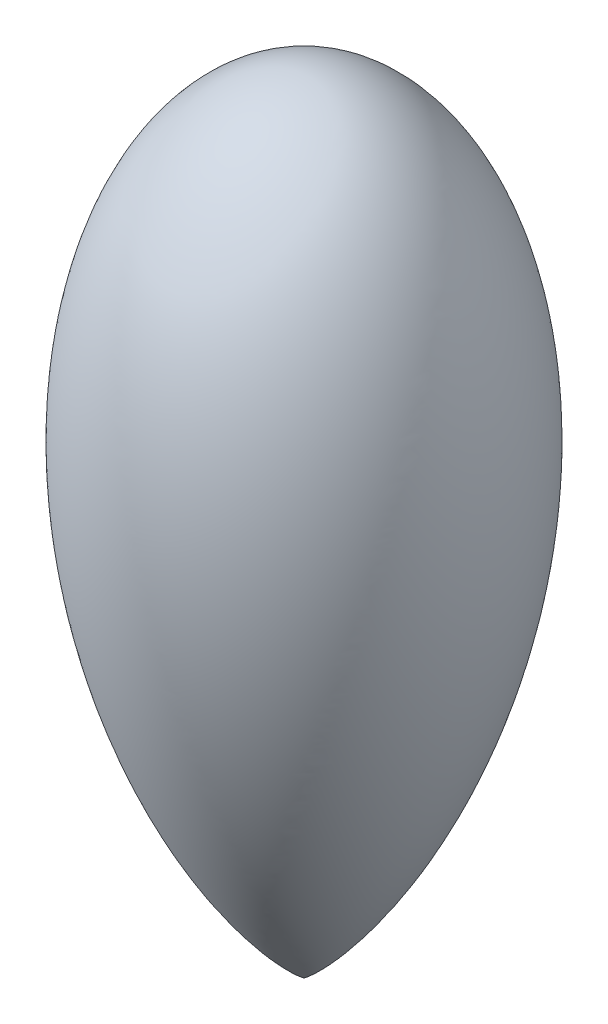
from build123d import *


with BuildPart() as part:
    # Sketch → Revolve 2 (revolve)
    with BuildSketch(Plane.XY):
        with BuildLine():
            Line((0, 397.88735773), (0, 0))
            add(Edge.make_bspline(
                [(0, 397.88735773), (0.142763625, 397.88735773), (0.428381043, 397.886231566), (0.960353225, 397.88116383), (1.535148694, 397.867652102), (2.331730097, 397.842324597), (3.246803667, 397.798444417), (4.337620845, 397.727621056), (5.567439546, 397.619865455), (6.802590902, 397.485435789), (8.029973634, 397.324505894), (9.256300325, 397.137281541), (10.47686203, 396.923999318), (11.997505999, 396.625156484), (13.811199953, 396.215547728), (15.909917497, 395.664697671), (18.280610107, 394.937999999), (20.620516548, 394.117367993), (22.926610288, 393.206259601), (25.196467356, 392.208298174), (27.985731378, 390.856962272), (31.252374207, 389.076715527), (34.655769288, 386.961468043), (38.162597245, 384.486727713), (41.278533823, 382.047149864), (44.03478943, 379.695399266), (46.712228243, 377.218856876), (49.309459025, 374.624260197), (52.458710603, 371.237111046), (56.061477594, 366.975711237), (59.987235037, 361.780670335), (64.301086928, 355.301256015), (68.405595265, 348.286566977), (72.111592664, 341.053624009), (75.443792469, 333.642399047), (78.315865157, 326.409780552), (80.788090559, 319.393915412), (83.000297793, 312.291991965), (84.964565187, 305.117720973), (87.123734603, 296.074187207), (89.260936231, 285.121341877), (91.13244365, 272.235269984), (92.478845353, 257.415887104), (93.083176306, 242.548610516), (92.963317475, 223.950196777), (91.489318872, 201.671593696), (87.95656127, 175.854453078), (82.385132936, 150.401479659), (76.213823763, 128.947781242), (70.153306593, 111.365996188), (64.755636395, 97.501990199), (58.806049893, 83.865481679), (52.29703594, 70.486657309), (46.100190521, 59.037239714), (40.416655336, 49.435441045), (35.421520285, 41.594228483), (31.264471127, 35.426633705), (27.115122499, 29.621503957), (22.987280347, 24.17589253), (19.381755066, 19.693695211), (16.364233569, 16.127759776), (13.785332758, 13.2120301), (11.681261568, 10.916286855), (9.581585473, 8.712295168), (7.735401238, 6.853589255), (6.158464047, 5.326143446), (4.865693859, 4.115609031), (3.817971372, 3.161796244), (2.75517559, 2.224780921), (1.809931471, 1.422536288), (1.054801178, 0.807143191), (0.496950104, 0.370472016), (0.214574658, 0.156617176), (0.07178537, 0.051854083), (0, 0)],
                knots=[0.078553141, 0.078553141, 0.078553141, 0.078553141, 0.078553141, 0.079781251, 0.081009362, 0.082237473, 0.083465583, 0.085921805, 0.088378026, 0.090834247, 0.093290469, 0.09574669, 0.098202911, 0.100659143, 0.103115376, 0.10802784, 0.112940305, 0.11785277, 0.122765241, 0.127677713, 0.132590185, 0.137502657, 0.147327514, 0.157152371, 0.164330348, 0.171508324, 0.178686301, 0.185864278, 0.193232952, 0.200601625, 0.215338973, 0.230076521, 0.24481407, 0.262270059, 0.279726047, 0.29446352, 0.309200993, 0.323938466, 0.338675938, 0.353413365, 0.368150792, 0.397625645, 0.427100499, 0.456575352, 0.486050209, 0.515525067, 0.574474804, 0.633424519, 0.6923742, 0.721849151, 0.751324101, 0.780798958, 0.810273814, 0.839748606, 0.869223397, 0.883960818, 0.898698238, 0.913435658, 0.928173078, 0.940514546, 0.952856014, 0.959026748, 0.965197482, 0.971368216, 0.97753895, 0.983154212, 0.985961844, 0.988769475, 0.991577106, 0.994384737, 0.997192369, 0.998596184, 0.999298092, 1, 1, 1, 1, 1], degree=4))
        make_face()
    revolve(axis=Axis((0, 397.88735773, 0), (0, -1, 0)))


solid = part.part
